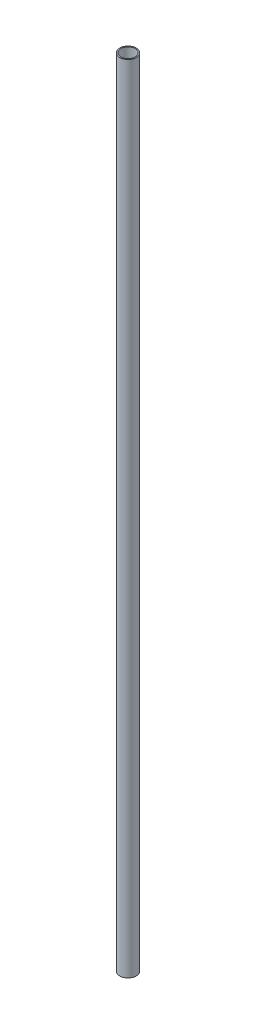
from build123d import *

# Parameters (mm, degrees)
SKETCH1_R           = 9.525
SKETCH1_R_2         = 8.2804
BOSS_EXTRUDE1_DEPTH = 914.4


with BuildPart() as part:
    # Sketch1 → Boss-Extrude1 (new body)
    with BuildSketch(Plane(origin=(0, 0, 0), x_dir=(1, 0, 0), z_dir=(0, 1, 0))):
        Circle(SKETCH1_R)
        Circle(SKETCH1_R_2, mode=Mode.SUBTRACT)
    extrude(amount=BOSS_EXTRUDE1_DEPTH)


solid = part.part
